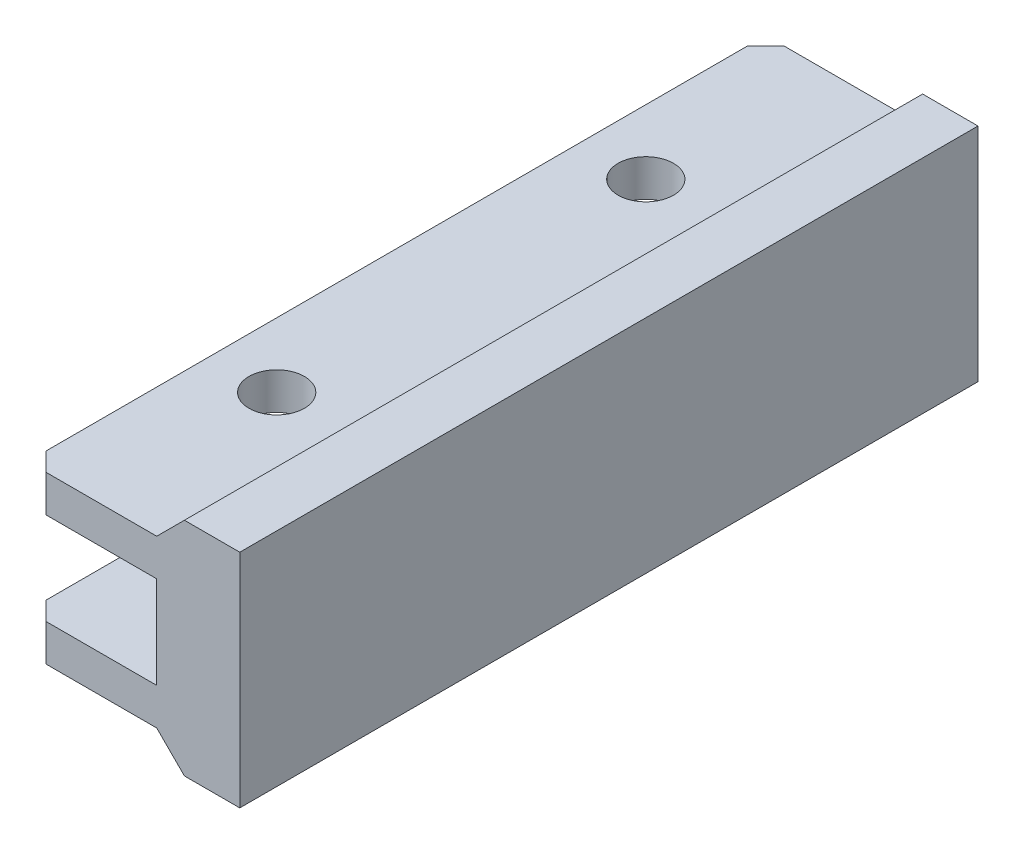
from build123d import *

# Parameters (mm, degrees)
SALIENTE_EXTRUIR1_DEPTH      = 20
TALADRO_DE_MARGEN_PARA_M31_D = 3
CHAFL_N2_SIZE                = 1


with BuildPart() as part:
    # Croquis1 → Saliente-Extruir1 (new, symmetric)
    with BuildSketch(Plane(origin=(0, 0, 0), x_dir=(0, 1, 0), z_dir=(0, 0, 1))):
        Polygon((-6, 0), (6, 0), (6, 3), (4.5, 4.5), (4.5, 11.5), (2.5, 11.5), (2.5, 4.5), (-2.5, 4.5), (-2.5, 11.5), (-4.5, 11.5), (-4.5, 4.5), (-6, 3), align=None)
    extrude(amount=SALIENTE_EXTRUIR1_DEPTH, both=True)

    # Taladro de margen para M31 (through all)
    with Locations(Plane(origin=(0, 4.5, 0), x_dir=(-1, 0, 0), z_dir=(0, 1, 0))):
        with Locations((8, -10), (8, 10)):
            Hole(TALADRO_DE_MARGEN_PARA_M31_D / 2)

    # Chaflán2
    chafl_n2_edges = [part.edges().sort_by_distance(p)[0] for p in [
        (-11.5, -3.5, -20),
        (-11.5, 3.5, -20),
        (-11.5, 3.5, 20),
        (-11.5, -3.5, 20),
    ]]
    chamfer(chafl_n2_edges, length=CHAFL_N2_SIZE)


solid = part.part
